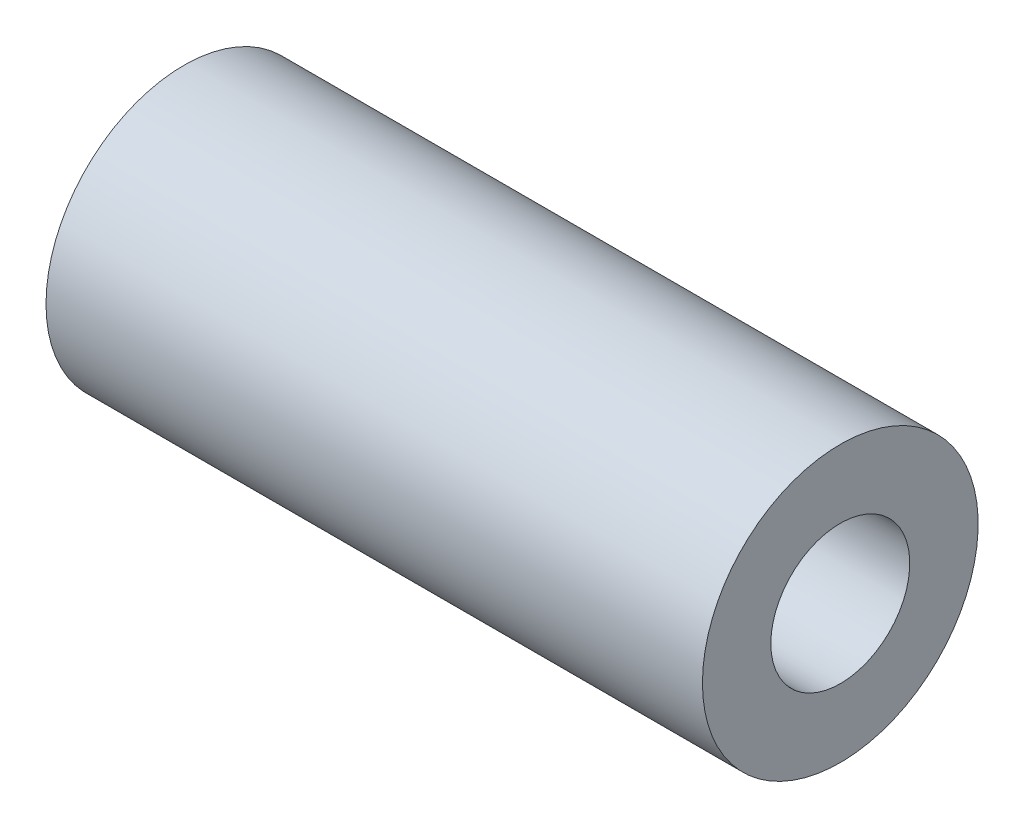
from build123d import *

# Parameters (mm, degrees)
SOCKET_1_SKETCH_W = 17.8
SOCKET_1_SKETCH_H = 4.7625
SOCKET_2_SKETCH_W = 17.8
SOCKET_2_SKETCH_H = 4.7625


with BuildPart() as part:
    # Union_T6 Sketch → Union_T6 (revolve)
    with BuildSketch(Plane.XY):
        Polygon((-22.5, 0), (-22.5, 9.45), (-0.5, 9.45), (0.5, 9.45), (22.5, 9.45), (22.5, 0), align=None)
    revolve(axis=Axis((-1000, 0, 0), (1, 0, 0)))

    # Socket 1 Sketch → Socket 1 (revolve, cut)
    with BuildSketch(Plane.XY):
        with Locations((-14.6, 2.38125)):
            Rectangle(SOCKET_1_SKETCH_W, SOCKET_1_SKETCH_H)
    revolve(axis=Axis((-1000, 0, 0), (1, 0, 0)), mode=Mode.SUBTRACT)

    # Socket 2 Sketch → Socket 2 (revolve, cut)
    with BuildSketch(Plane.XY):
        with Locations((14.6, 2.38125)):
            Rectangle(SOCKET_2_SKETCH_W, SOCKET_2_SKETCH_H)
    revolve(axis=Axis((-1000, 0, 0), (1, 0, 0)), mode=Mode.SUBTRACT)


solid = part.part
